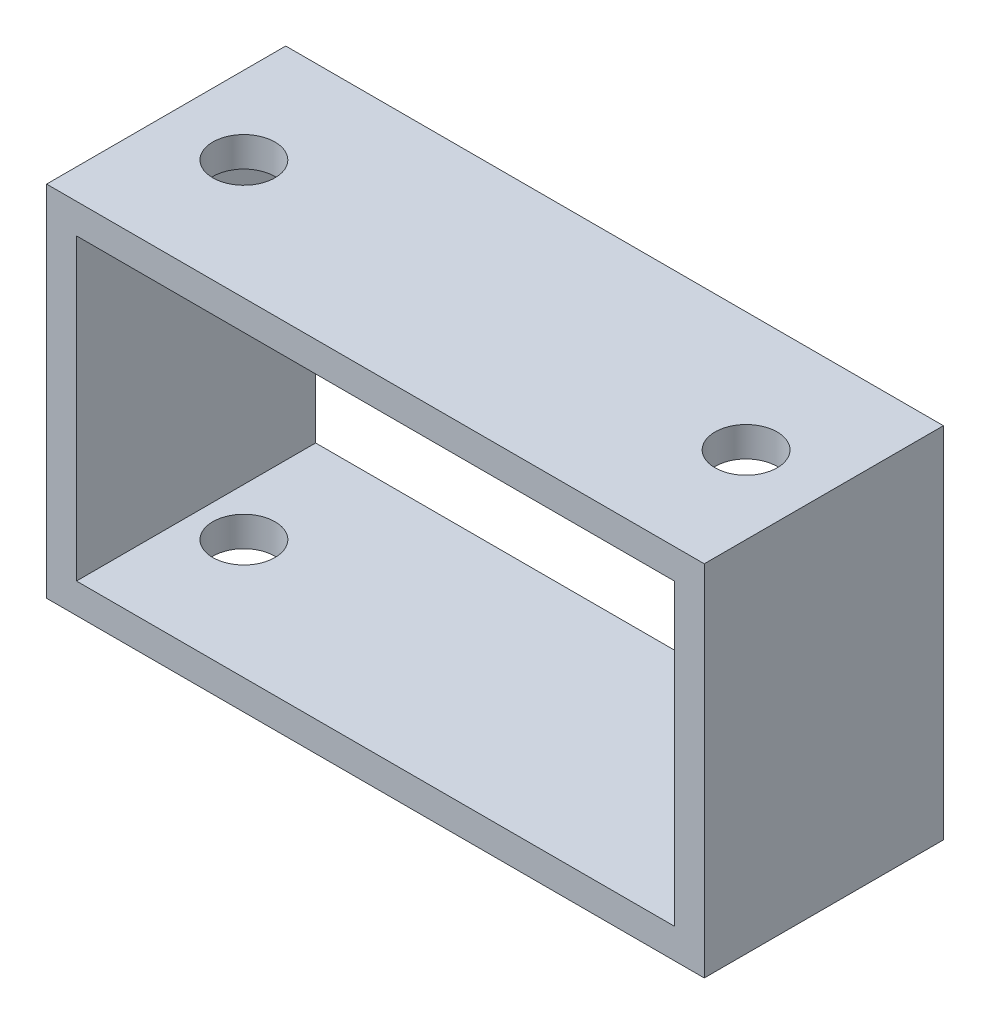
from build123d import *

# Parameters (mm, degrees)
SKETCH_1_W          = 55
SKETCH_1_H          = 20
EXTRUDE_1_DEPTH     = 30
CUT_EXTRUDE_1_REACH = 47.346
SKETCH_2_W          = 50
SKETCH_2_H          = 25
CUT_EXTRUDE_2_REACH = 43.908
SKETCH_3_R          = 2.6


with BuildPart() as part:
    # 草图1 → 凸台-拉伸1 (new body)
    with BuildSketch(Plane(origin=(0, 0, 0), x_dir=(1, 0, 0), z_dir=(0, 1, 0))):
        Rectangle(SKETCH_1_W, SKETCH_1_H)
    extrude(amount=EXTRUDE_1_DEPTH)

    # 草图2 → 切除-拉伸1 (cut, up to next)
    with BuildSketch(Plane.XY.offset(10), mode=Mode.PRIVATE) as cut_extrude_1_sk1:
        with Locations((0, 15)):
            Rectangle(SKETCH_2_W, SKETCH_2_H)
    cut_extrude_1_tool1 = extrude(cut_extrude_1_sk1.sketch, amount=-CUT_EXTRUDE_1_REACH, mode=Mode.PRIVATE) & part.part
    add(cut_extrude_1_tool1.solids().sort_by_distance((0, 15, 10))[0], mode=Mode.SUBTRACT)

    # 切除-拉伸2: up to this face of the body (flat: up to its plane)
    cut_extrude_2_end = Plane(part.part.faces().sort_by_distance((0, 0, 0))[0])
    # 草图3 → 切除-拉伸2 (cut, up to the picked face)
    with BuildSketch(Plane(origin=(0, 30, 0), x_dir=(1, 0, 0), z_dir=(0, 1, 0)), mode=Mode.PRIVATE) as cut_extrude_2_sk1:
        with Locations(Location((-21, 0, 0), (0, 0, 270))):
            Circle(SKETCH_3_R)
    cut_extrude_2_tool1 = split(extrude(cut_extrude_2_sk1.sketch, amount=-CUT_EXTRUDE_2_REACH, mode=Mode.PRIVATE), bisect_by=cut_extrude_2_end, keep=Keep.BOTH, mode=Mode.PRIVATE)
    # 草图3 → 切除-拉伸2 (cut, up to the picked face)
    with BuildSketch(Plane(origin=(0, 30, 0), x_dir=(1, 0, 0), z_dir=(0, 1, 0)), mode=Mode.PRIVATE) as cut_extrude_2_sk2:
        with Locations(Location((21, 0, 0), (0, 0, 270))):
            Circle(SKETCH_3_R)
    cut_extrude_2_tool2 = split(extrude(cut_extrude_2_sk2.sketch, amount=-CUT_EXTRUDE_2_REACH, mode=Mode.PRIVATE), bisect_by=cut_extrude_2_end, keep=Keep.BOTH, mode=Mode.PRIVATE)
    add(cut_extrude_2_tool1.solids().sort_by(Axis((-21, 30, 0), (0, -1, 0)))[0], mode=Mode.SUBTRACT)
    add(cut_extrude_2_tool2.solids().sort_by(Axis((21, 30, 0), (0, -1, 0)))[0], mode=Mode.SUBTRACT)


solid = part.part
